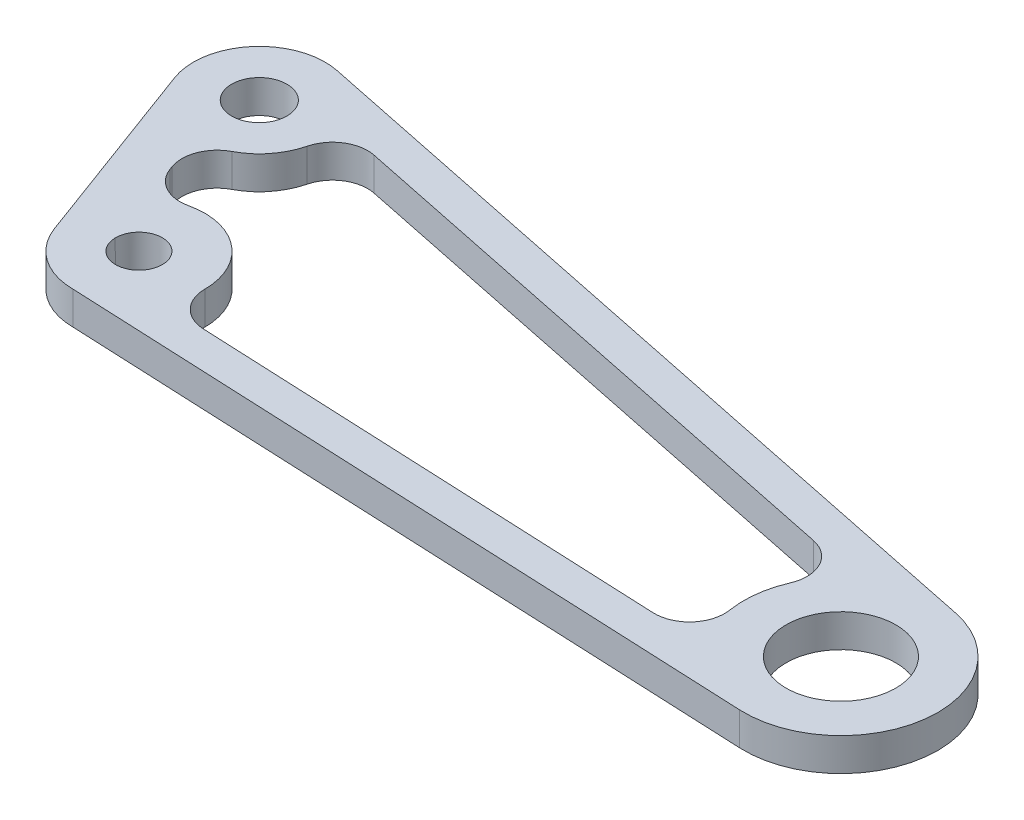
from build123d import *

# Parameters (mm, degrees)
SKETCH1_R           = 4
SKETCH1_R_2         = 7.9375
SKETCH1_R_3         = 3.3782
BOSS_EXTRUDE2_DEPTH = 4.7625
CUT_EXTRUDE1_DEPTH  = 122.517222726
FILLET1_R           = 5.08


with BuildPart() as part:
    # Sketch1 → Boss-Extrude2 (new body)
    with BuildSketch(Plane(origin=(0, 0, 0), x_dir=(1, 0, 0), z_dir=(0, 1, 0))):
        with BuildLine():
            Line((104.396235267, 13.744819308), (-8.304416732, 36.964125856))
            ThreePointArc((-8.304416732, 36.964125856), (-17.451234138, 33.842164964), (-19.159429037, 24.329385209))
            Line((-19.159429037, 24.329385209), (-8.932978723, -3.305679376))
            ThreePointArc((-8.932978723, -3.305679376), (-5.442381324, -7.817039755), (0, -9.525))
            Line((0, -9.525), (100.940182628, -14.019608589))
            ThreePointArc((100.940182628, -14.019608589), (115.490464917, -1.733479809), (104.396235267, 13.744819308))
        make_face()
        with Locations((-10.226449718, 27.635062977)):
            Circle(SKETCH1_R, mode=Mode.SUBTRACT)
        with Locations((101.56444, 0)):
            Circle(SKETCH1_R_2, mode=Mode.SUBTRACT)
        Circle(SKETCH1_R_3, mode=Mode.SUBTRACT)
    extrude(amount=BOSS_EXTRUDE2_DEPTH)

    # Sketch2 → Cut-Extrude1 (cut, through all)
    with BuildSketch(Plane(origin=(0, 4.7625, 0), x_dir=(1, 0, 0), z_dir=(0, 1, 0))):
        with BuildLine():
            Line((-10.087484888, 18.111076743), (-6.094283979, 7.320199983))
            ThreePointArc((-6.094283979, 7.320199983), (6.155929185, 7.26843593), (8.223542142, -4.806139786))
            Line((8.223542142, -4.806139786), (90.370654862, -8.463940958))
            ThreePointArc((90.370654862, -8.463940958), (87.638415083, 1.733479809), (92.787243401, 10.949883201))
            Line((92.787243401, 10.949883201), (-1.078567334, 30.28871572))
            ThreePointArc((-1.078567334, 30.28871572), (-2.569093415, 21.970213513), (-10.087484888, 18.111076743))
        make_face()
    extrude(amount=-CUT_EXTRUDE1_DEPTH, mode=Mode.SUBTRACT)

    # Fillet1
    fillet1_edges = [part.edges().sort_by_distance(p)[0] for p in [
        (-10.087484888, 2.38125, -18.111076743),
        (-6.094283979, 2.38125, -7.320199983),
        (92.787243401, 2.38125, -10.949883201),
        (90.370654862, 2.38125, 8.463940958),
        (-1.078567334, 2.38125, -30.28871572),
        (8.223542142, 2.38125, 4.806139786),
    ]]
    fillet(fillet1_edges, radius=FILLET1_R)


solid = part.part
